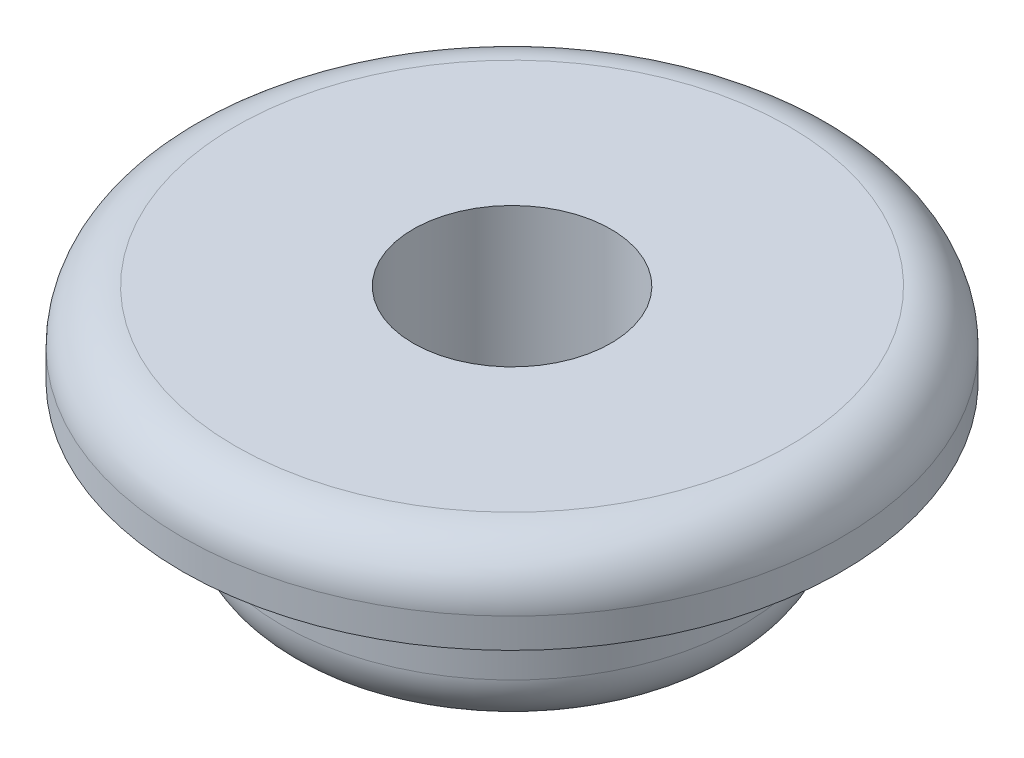
from build123d import *

# Parameters (mm, degrees)
SKETCH1_R           = 5.55625
BOSS_EXTRUDE1_DEPTH = 2.778125
SKETCH2_R           = 7.9375
BOSS_EXTRUDE2_DEPTH = 2.54
SKETCH3_R           = 8.070808391
SKETCH3_R_2         = 3.96875
CUT_EXTRUDE1_DEPTH  = 0.79375
SKETCH4_R           = 2.38125
CUT_EXTRUDE2_DEPTH  = 13.525163734
FILLET1_R           = 1.27


with BuildPart() as part:
    # Sketch1 → Boss-Extrude1 (new, symmetric)
    with BuildSketch(Plane(origin=(0, 0, 0), x_dir=(1, 0, 0), z_dir=(0, 1, 0))):
        with Locations(Location((0, 0, 0), (0, 0, 270))):
            Circle(SKETCH1_R)
    extrude(amount=BOSS_EXTRUDE1_DEPTH, both=True)

    # Sketch2 → Boss-Extrude2 (add)
    with BuildSketch(Plane(origin=(0, 2.778125, 0), x_dir=(1, 0, 0), z_dir=(0, 1, 0))):
        with Locations(Location((0, 0, 0), (0, 0, 270))):
            Circle(SKETCH2_R)
    extrude(amount=-BOSS_EXTRUDE2_DEPTH)

    # Sketch3 → Cut-Extrude1 (cut, symmetric)
    with BuildSketch(Plane(origin=(0, 0, 0), x_dir=(1, 0, 0), z_dir=(0, 1, 0))):
        Circle(SKETCH3_R)
        with Locations(Location((0, 0, 0), (0, 0, 270))):
            Circle(SKETCH3_R_2, mode=Mode.SUBTRACT)
    extrude(amount=CUT_EXTRUDE1_DEPTH, both=True, mode=Mode.SUBTRACT)

    # Sketch4 → Cut-Extrude2 (cut, through all)
    with BuildSketch(Plane(origin=(0, 2.778125, 0), x_dir=(1, 0, 0), z_dir=(0, 1, 0))):
        with Locations(Location((0, 0, 0), (0, 0, 270))):
            Circle(SKETCH4_R)
    extrude(amount=-CUT_EXTRUDE2_DEPTH, mode=Mode.SUBTRACT)

    # Fillet1
    fillet1_edges = [part.edges().sort_by_distance(p)[0] for p in [
        (0, -2.778125, -5.55625),
        (0, 2.778125, -7.9375),
    ]]
    fillet(fillet1_edges, radius=FILLET1_R)


solid = part.part
